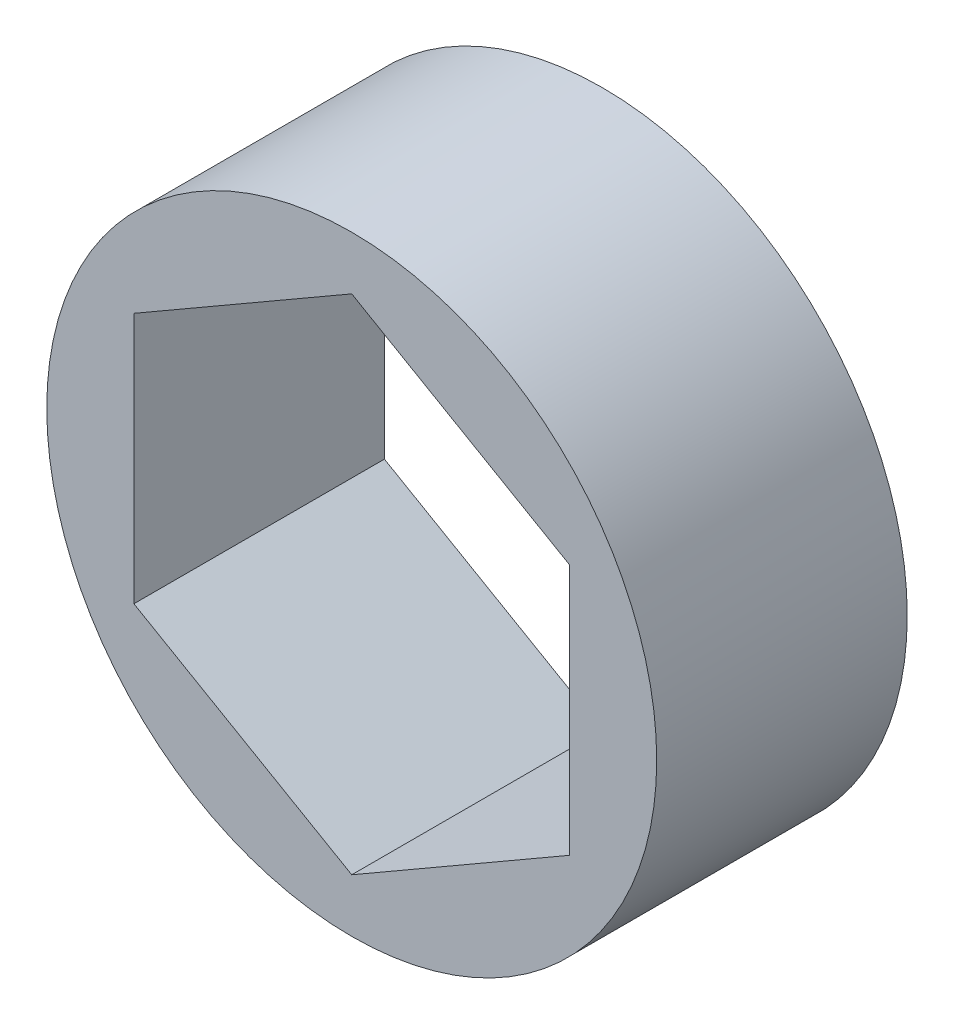
from build123d import *

# Parameters (mm, degrees)
SKETCH1_R           = 8.89
BOSS_EXTRUDE1_DEPTH = 3.65125


with BuildPart() as part:
    # Sketch1 → Boss-Extrude1 (new, symmetric)
    with BuildSketch(Plane.XY):
        with Locations(Location((0, 0, 0), (0, 0, 180))):
            Circle(SKETCH1_R)
        Polygon((0, 7.332348419), (-6.35, 3.666174209), (-6.35, -3.666174209), (0, -7.332348419), (6.35, -3.666174209), (6.35, 3.666174209), align=None, mode=Mode.SUBTRACT)
    extrude(amount=BOSS_EXTRUDE1_DEPTH, both=True)


solid = part.part
